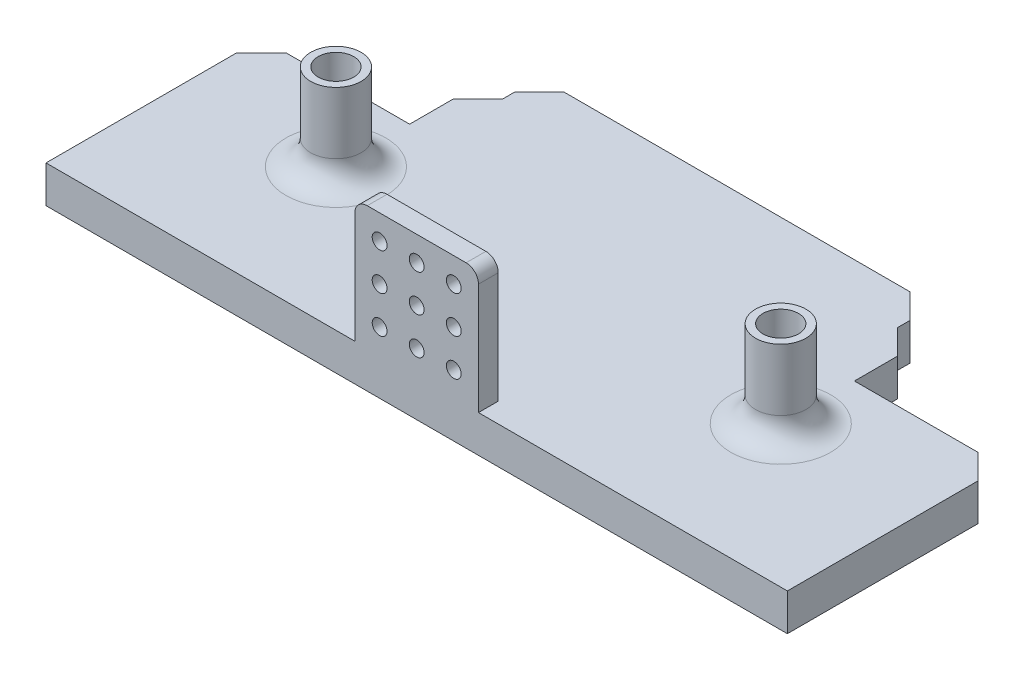
from build123d import *

# Parameters (mm, degrees)
SKETCH1_W           = 150
SKETCH1_H           = 57.32
BOSS_EXTRUDE1_DEPTH = 7.5
SKETCH2_R           = 5.1
BOSS_EXTRUDE2_DEPTH = 17.5
FILLET1_R           = 5
SKETCH3_R           = 3.6
CUT_EXTRUDE1_DEPTH  = 25
SKETCH4_W           = 30
SKETCH4_H           = 7.5
CUT_EXTRUDE2_DEPTH  = 13.75
CHAMFER1_SIZE       = 5
SKETCH5_W           = 80
SKETCH5_H           = 7.5
BOSS_EXTRUDE3_DEPTH = 7.5
CHAMFER2_SIZE       = 5
SKETCH6_R           = 1.5
CUT_EXTRUDE3_DEPTH  = 7.5
SKETCH7_W           = 25
SKETCH7_H           = 4
BOSS_EXTRUDE4_DEPTH = 25
SKETCH8_R           = 1.5
CUT_EXTRUDE4_DEPTH  = 5
FILLET2_R           = 2.5


with BuildPart() as part:
    # Sketch1 → Boss-Extrude1 (new body)
    with BuildSketch(Plane(origin=(0, 0, 0), x_dir=(1, 0, 0), z_dir=(0, 1, 0))):
        Rectangle(SKETCH1_W, SKETCH1_H)
    extrude(amount=BOSS_EXTRUDE1_DEPTH)

    # Sketch2 → Boss-Extrude2 (add)
    with BuildSketch(Plane(origin=(0, 7.5, 0), x_dir=(1, 0, 0), z_dir=(0, 1, 0))):
        with Locations(Location((-45, 0, 0), (0, 0, 270))):
            Circle(SKETCH2_R)
        with Locations(Location((45, 0, 0), (0, 0, 270))):
            Circle(SKETCH2_R)
    extrude(amount=BOSS_EXTRUDE2_DEPTH)

    # Fillet1
    fillet1_edges = [part.edges().sort_by_distance(p)[0] for p in [
        (-45, 7.5, -5.1),
        (45, 7.5, -5.1),
    ]]
    fillet(fillet1_edges, radius=FILLET1_R)

    # Sketch3 → Cut-Extrude1 (cut)
    with BuildSketch(Plane(origin=(0, 25, 0), x_dir=(1, 0, 0), z_dir=(0, 1, 0))):
        with Locations(Location((-45, 0, 0), (0, 0, 270))):
            Circle(SKETCH3_R)
        with Locations(Location((45, 0, 0), (0, 0, 270))):
            Circle(SKETCH3_R)
    extrude(amount=-CUT_EXTRUDE1_DEPTH, mode=Mode.SUBTRACT)

    # Sketch4 → Cut-Extrude2 (cut)
    with BuildSketch(Plane(origin=(0, 0, -28.66), x_dir=(-1, 0, 0), z_dir=(0, 0, -1))):
        with Locations((-60, 3.75)):
            Rectangle(SKETCH4_W, SKETCH4_H)
        with Locations((60, 3.75)):
            Rectangle(SKETCH4_W, SKETCH4_H)
    extrude(amount=-CUT_EXTRUDE2_DEPTH, mode=Mode.SUBTRACT)

    # Chamfer1
    chamfer1_edges = [part.edges().sort_by_distance(p)[0] for p in [
        (75, 3.75, -14.91),
        (45, 3.75, -28.66),
        (-75, 3.75, -14.91),
        (-45, 3.75, -28.66),
    ]]
    chamfer(chamfer1_edges, length=CHAMFER1_SIZE)

    # Sketch5 → Boss-Extrude3 (add)
    with BuildSketch(Plane(origin=(0, 0, -28.66), x_dir=(-1, 0, 0), z_dir=(0, 0, -1))):
        with Locations((0, 3.75)):
            Rectangle(SKETCH5_W, SKETCH5_H)
    extrude(amount=BOSS_EXTRUDE3_DEPTH)

    # Chamfer2
    chamfer2_edges = [part.edges().sort_by_distance(p)[0] for p in [
        (40, 3.75, -36.16),
        (-40, 3.75, -36.16),
    ]]
    chamfer(chamfer2_edges, length=CHAMFER2_SIZE)

    # Sketch6 → Cut-Extrude3 (cut)
    with BuildSketch(Plane(origin=(0, 0, -36.16), x_dir=(-1, 0, 0), z_dir=(0, 0, -1))):
        with Locations((-15, 3.75)):
            Circle(SKETCH6_R)
        with Locations((15, 3.75)):
            Circle(SKETCH6_R)
    extrude(amount=-CUT_EXTRUDE3_DEPTH, mode=Mode.SUBTRACT)

    # Sketch7 → Boss-Extrude4 (add)
    with BuildSketch(Plane(origin=(0, 7.5, 0), x_dir=(1, 0, 0), z_dir=(0, 1, 0))):
        with Locations((0, -26.66)):
            Rectangle(SKETCH7_W, SKETCH7_H)
    extrude(amount=BOSS_EXTRUDE4_DEPTH)

    # Sketch8 → Cut-Extrude4 (cut)
    with BuildSketch(Plane(origin=(0, 0, 24.66), x_dir=(-1, 0, 0), z_dir=(0, 0, -1))):
        with Locations((-7.5, 20)):
            Circle(SKETCH8_R)
        with Locations((0, 20)):
            Circle(SKETCH8_R)
        with Locations((-7.5, 27.5)):
            Circle(SKETCH8_R)
        with Locations((0, 27.5)):
            Circle(SKETCH8_R)
        with Locations((7.5, 27.5)):
            Circle(SKETCH8_R)
        with Locations((7.5, 20)):
            Circle(SKETCH8_R)
        with Locations((-7.5, 12.5)):
            Circle(SKETCH8_R)
        with Locations((0, 12.5)):
            Circle(SKETCH8_R)
        with Locations((7.5, 12.5)):
            Circle(SKETCH8_R)
    extrude(amount=-CUT_EXTRUDE4_DEPTH, mode=Mode.SUBTRACT)

    # Fillet2
    fillet2_edges = [part.edges().sort_by_distance(p)[0] for p in [
        (-12.5, 32.5, 26.66),
        (12.5, 32.5, 26.66),
    ]]
    fillet(fillet2_edges, radius=FILLET2_R)


solid = part.part
